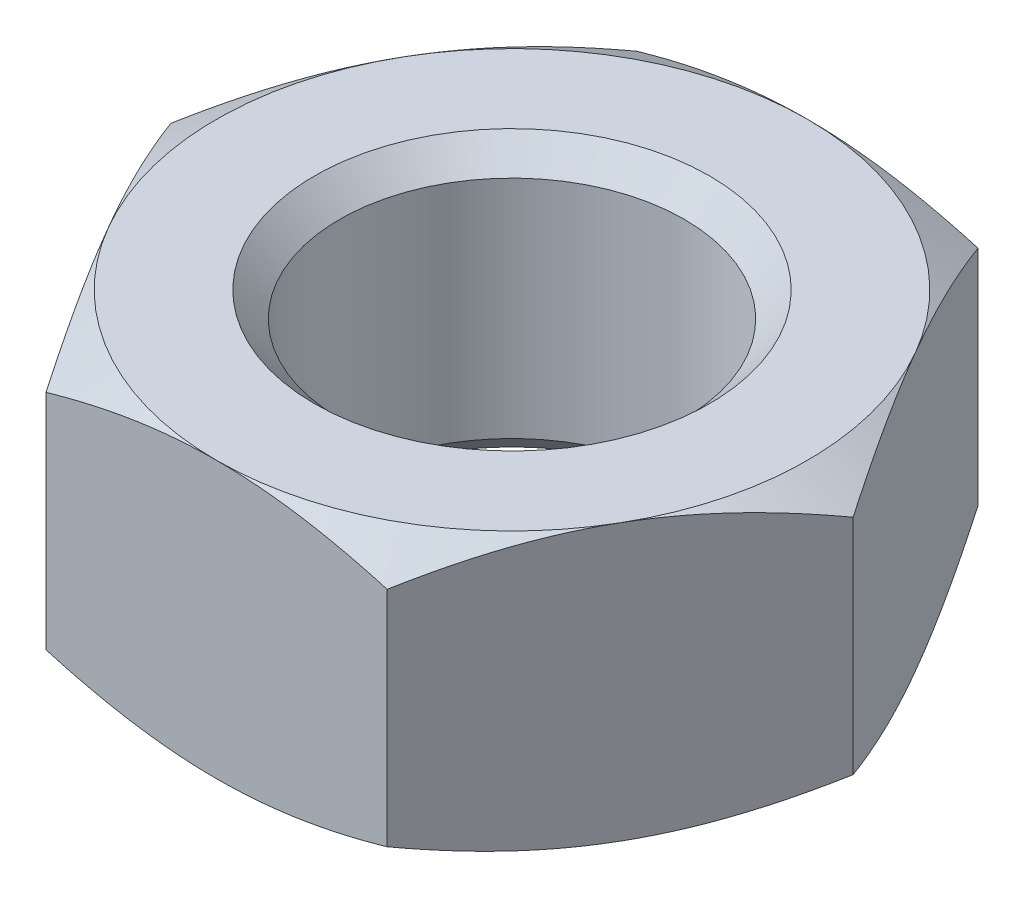
from build123d import *

# Parameters (mm, degrees)
EXTRUDE_1_DEPTH = 14


with BuildPart() as part:
    # Эскиз1 → Бобышка-Вытянуть1 (new body)
    with BuildSketch(Plane(origin=(0, 0, 0), x_dir=(1, 0, 0), z_dir=(0, 1, 0))):
        Polygon((-8.660254038, 15), (-17.320508076, 0), (-8.660254038, -15), (8.660254038, -15), (17.320508076, 0), (8.660254038, 15), align=None)
    extrude(amount=EXTRUDE_1_DEPTH)

    # Эскиз2 → Вырез-Повернуть1 (revolve, cut)
    with BuildSketch(Plane(origin=(0, 0, 0), x_dir=(0, 0, -1), z_dir=(1, 0, 0))):
        Polygon((-15, 14), (-20, 14), (-20, 11.113248654), align=None)
        Polygon((-15, 0), (-20, 0), (-20, 2.886751346), align=None)
    revolve(axis=Axis((0, -1000, 0), (0, 1, 0)), mode=Mode.SUBTRACT)

    # Эскиз3 → Отверстие обработанное метчиком M20x2.51 (revolve, cut)
    with BuildSketch(Plane(origin=(0, 0, 0), x_dir=(0, 0, -1), z_dir=(1, 0, 0))):
        Polygon((0, 0), (0, 14), (10.025, 14), (8.75, 12.725), (8.75, 1.275), (10.025, 0), align=None)
    revolve(axis=Axis((0, -6.35, 0), (0, 1, 0)), mode=Mode.SUBTRACT)


solid = part.part
